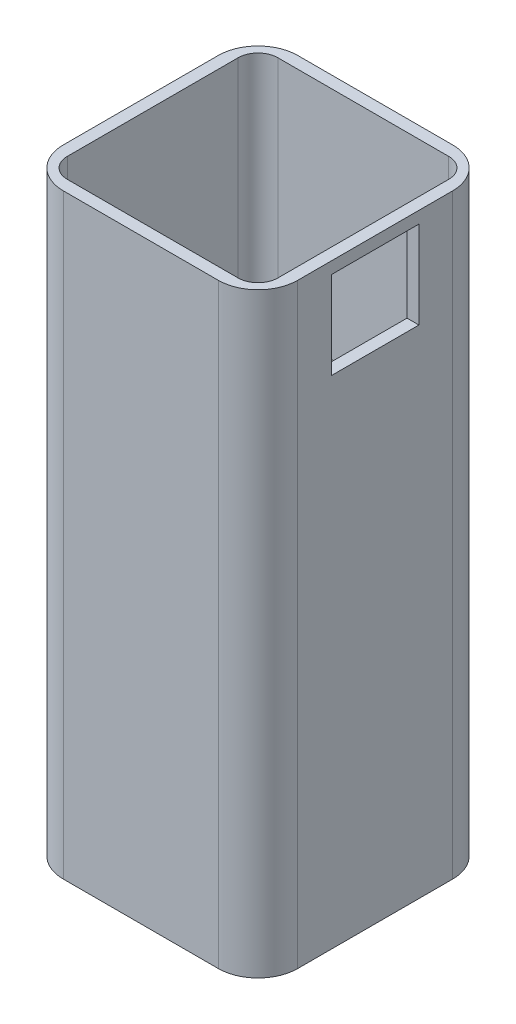
from build123d import *

# Parameters (mm, degrees)
SKETCH1_W           = 59
SKETCH1_H           = 59
SKETCH1_W_2         = 53
SKETCH1_H_2         = 53
BOSS_EXTRUDE1_DEPTH = 150
FILLET1_R           = 10
FILLET2_R           = 5
SKETCH3_W           = 22
SKETCH3_H           = 22
CUT_EXTRUDE2_DEPTH  = 3
CUT_EXTRUDE4_REACH  = 165.864
SKETCH5_W           = 22
SKETCH5_H           = 22


with BuildPart() as part:
    # Sketch1 → Boss-Extrude1 (new body)
    with BuildSketch(Plane(origin=(0, 0, 0), x_dir=(1, 0, 0), z_dir=(0, 1, 0))):
        Rectangle(SKETCH1_W, SKETCH1_H)
        Rectangle(SKETCH1_W_2, SKETCH1_H_2, mode=Mode.SUBTRACT)
    extrude(amount=BOSS_EXTRUDE1_DEPTH)

    # Fillet1
    fillet1_edges = [part.edges().sort_by_distance(p)[0] for p in [
        (29.5, 75, 29.5),
        (-29.5, 75, 29.5),
        (-29.5, 75, -29.5),
        (29.5, 75, -29.5),
    ]]
    fillet(fillet1_edges, radius=FILLET1_R)

    # Fillet2
    fillet2_edges = [part.edges().sort_by_distance(p)[0] for p in [
        (26.5, 75, 26.5),
        (26.5, 75, -26.5),
        (-26.5, 75, -26.5),
        (-26.5, 75, 26.5),
    ]]
    fillet(fillet2_edges, radius=FILLET2_R)

    # Sketch3 → Cut-Extrude2 (cut)
    with BuildSketch(Plane(origin=(0, 0, -29.5), x_dir=(-1, 0, 0), z_dir=(0, 0, -1))):
        with Locations((0, 80)):
            Rectangle(SKETCH3_W, SKETCH3_H)
    extrude(amount=-CUT_EXTRUDE2_DEPTH, mode=Mode.SUBTRACT)

    # Sketch5 → Cut-Extrude4 (cut, up to next)
    with BuildSketch(Plane(origin=(29.5, 0, 0), x_dir=(0, 0, -1), z_dir=(1, 0, 0)), mode=Mode.PRIVATE) as cut_extrude4_sk1:
        with Locations((0, 136)):
            Rectangle(SKETCH5_W, SKETCH5_H)
    cut_extrude4_tool1 = extrude(cut_extrude4_sk1.sketch, amount=-CUT_EXTRUDE4_REACH, mode=Mode.PRIVATE) & part.part
    add(cut_extrude4_tool1.solids().sort_by_distance((29.5, 136, 0))[0], mode=Mode.SUBTRACT)


solid = part.part
